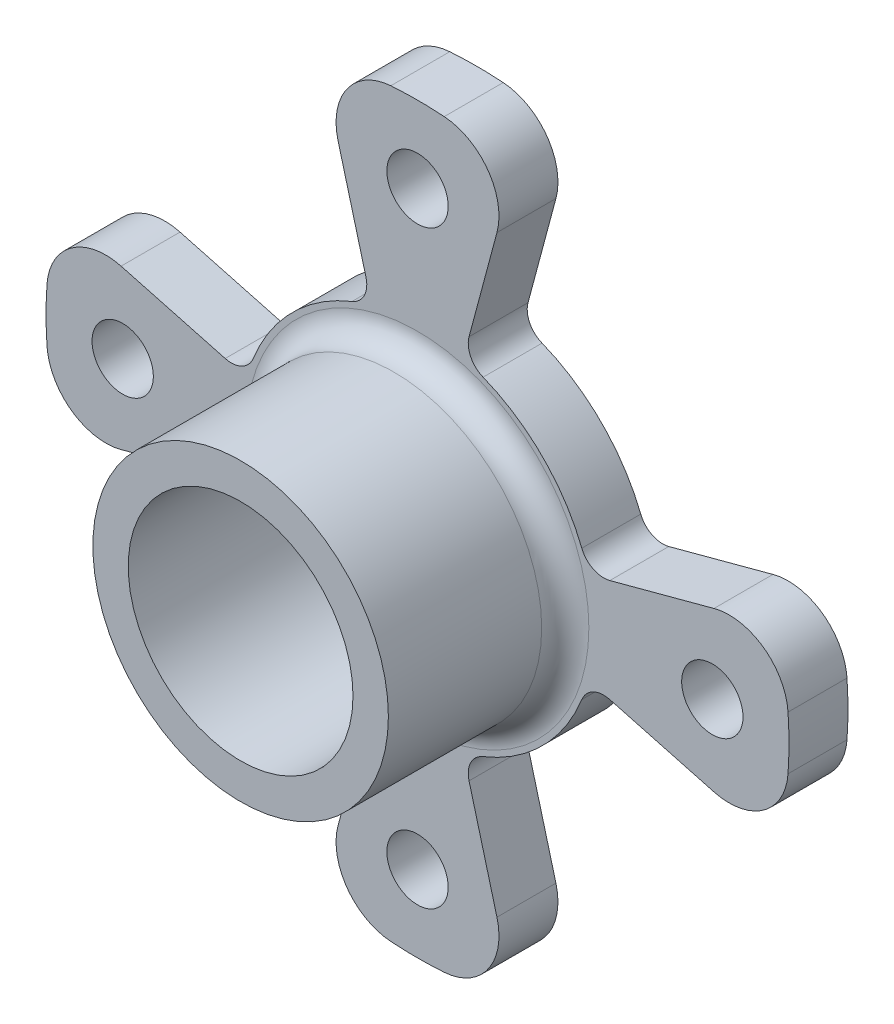
from build123d import *

# Parameters (mm, degrees)
SKETCH1_R           = 31.5
SKETCH1_R_2         = 2.6
BOSS_EXTRUDE1_DEPTH = 5
SKETCH2_R           = 12.53
SKETCH2_R_2         = 9.53
BOSS_EXTRUDE2_DEPTH = 15
CUT_EXTRUDE1_START  = -7
CUT_EXTRUDE1_DEPTH  = 7
FILLET1_R           = 5
FILLET2_R           = 2
FILLET3_R           = 2


with BuildPart() as part:
    # Sketch1 → Boss-Extrude1 (new body)
    with BuildSketch(Plane.XY):
        Circle(SKETCH1_R)
        with Locations((0, 25)):
            Circle(SKETCH1_R_2, mode=Mode.SUBTRACT)
        with Locations((25, 0)):
            Circle(SKETCH1_R_2, mode=Mode.SUBTRACT)
        with Locations((0, -25)):
            Circle(SKETCH1_R_2, mode=Mode.SUBTRACT)
        with Locations((-25, 0)):
            Circle(SKETCH1_R_2, mode=Mode.SUBTRACT)
    extrude(amount=BOSS_EXTRUDE1_DEPTH)

    # Sketch2 → Boss-Extrude2 (add)
    with BuildSketch(Plane.XY.offset(5)):
        Circle(SKETCH2_R)
        Circle(SKETCH2_R_2, mode=Mode.SUBTRACT)
    extrude(amount=BOSS_EXTRUDE2_DEPTH)

    # Sketch3 → Cut-Extrude1 (cut)
    with BuildSketch(Plane.XY.offset(5).offset(CUT_EXTRUDE1_START)):
        with BuildLine():
            ThreePointArc((-14.488887394, 3.882285677), (-10.606601718, 10.606601718), (-3.882285677, 14.488887394))
            Line((-3.882285677, 14.488887394), (-8.152799921, 30.426663528))
            ThreePointArc((-8.152799921, 30.426663528), (-22.273863607, 22.273863607), (-30.426663528, 8.152799921))
            Line((-30.426663528, 8.152799921), (-14.488887394, 3.882285677))
        make_face()
        with BuildLine():
            Line((8.152799921, 30.426663528), (3.882285677, 14.488887394))
            ThreePointArc((3.882285677, 14.488887394), (10.606601718, 10.606601718), (14.488887394, 3.882285677))
            Line((14.488887394, 3.882285677), (30.426663528, 8.152799921))
            ThreePointArc((30.426663528, 8.152799921), (22.273863607, 22.273863607), (8.152799921, 30.426663528))
        make_face()
        with BuildLine():
            Line((30.426663528, -8.152799921), (14.488887394, -3.882285677))
            ThreePointArc((14.488887394, -3.882285677), (10.606601718, -10.606601718), (3.882285677, -14.488887394))
            Line((3.882285677, -14.488887394), (8.152799921, -30.426663528))
            ThreePointArc((8.152799921, -30.426663528), (22.273863607, -22.273863607), (30.426663528, -8.152799921))
        make_face()
        with BuildLine():
            Line((-8.152799921, -30.426663528), (-3.882285677, -14.488887394))
            ThreePointArc((-3.882285677, -14.488887394), (-10.606601718, -10.606601718), (-14.488887394, -3.882285677))
            Line((-14.488887394, -3.882285677), (-30.426663528, -8.152799921))
            ThreePointArc((-30.426663528, -8.152799921), (-22.273863607, -22.273863607), (-8.152799921, -30.426663528))
        make_face()
    extrude(amount=CUT_EXTRUDE1_DEPTH, mode=Mode.SUBTRACT)

    # Fillet1
    fillet1_edges = [part.edges().sort_by_distance(p)[0] for p in [
        (-8.152799921, -30.426663528, 2.5),
        (-30.426663528, -8.152799921, 2.5),
        (30.426663528, -8.152799921, 2.5),
        (8.152799921, -30.426663528, 2.5),
        (8.152799921, 30.426663528, 2.5),
        (30.426663528, 8.152799921, 2.5),
        (-30.426663528, 8.152799921, 2.5),
        (-8.152799921, 30.426663528, 2.5),
    ]]
    fillet(fillet1_edges, radius=FILLET1_R)

    # Fillet2
    fillet2_edges = [part.edges().sort_by_distance(p)[0] for p in [
        (-14.488887394, -3.882285677, 2.5),
        (-3.882285677, -14.488887394, 2.5),
        (3.882285677, -14.488887394, 2.5),
        (14.488887394, -3.882285677, 2.5),
        (14.488887394, 3.882285677, 2.5),
        (3.882285677, 14.488887394, 2.5),
        (-3.882285677, 14.488887394, 2.5),
        (-14.488887394, 3.882285677, 2.5),
    ]]
    fillet(fillet2_edges, radius=FILLET2_R)

    # Fillet3
    fillet3_edges = [part.edges().sort_by_distance(p)[0] for p in [
        (-12.53, 0, 5),
    ]]
    fillet(fillet3_edges, radius=FILLET3_R)


solid = part.part
